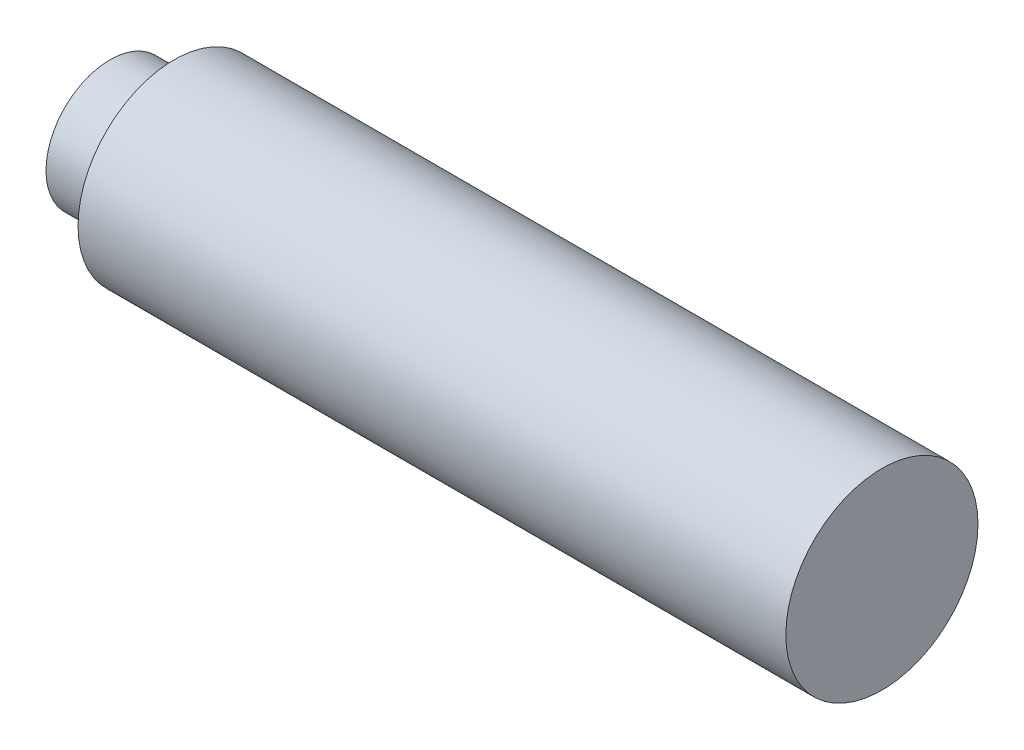
from build123d import *


with BuildPart() as part:
    # Esboço1 → Revolução1 (revolve)
    with BuildSketch(Plane.XY, mode=Mode.PRIVATE) as revolu_o1_sk:
        Polygon((-15.245, 0), (-15.245, 2.5), (-30.125, 2.5), (-30.125, 5), (-25.125, 5), (-25.125, 7.5), (30.125, 7.5), (30.125, 0), align=None)
    revolve(revolu_o1_sk.sketch.rotate(Axis((0, 0, 0), (1, 0, 0)), 90), axis=Axis((0, 0, 0), (1, 0, 0)))


solid = part.part
